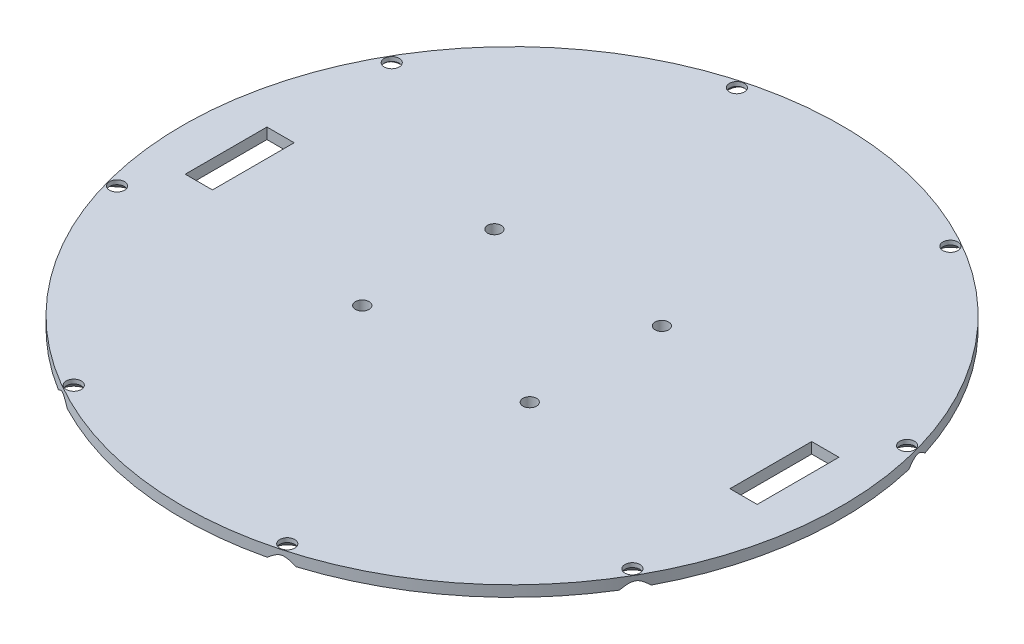
from build123d import *

# Parameters (mm, degrees)
BOTTOM_R                    = 121
BOTTOM_R_2                  = 2.5
BOTTOM_W                    = 10
BOTTOM_H                    = 30
BOTTOM_EXTRUDE_DEPTH        = 4
HOLE_WIZARD_827_D           = 5.5
HOLE_WIZARD_827_DEPTH       = 20
HOLE_WIZARD_827_CSINK_D     = 10.4
HOLE_WIZARD_827_CSINK_ANGLE = 90
HOLE_WIZARD_827_TIP         = 1.652366702


with BuildPart() as part:
    # Bottom → Bottom-Extrude (new body)
    with BuildSketch(Plane(origin=(0, 0, 0), x_dir=(-1, 0, 0), z_dir=(0, 1, 0))):
        with Locations(Location((0, 0, 0), (0, 0, 90))):
            Circle(BOTTOM_R)
        with Locations(Location((-30.75, -24.25, 0), (0, 0, 90))):
            Circle(BOTTOM_R_2, mode=Mode.SUBTRACT)
        with Locations(Location((30.75, -24.25, 0), (0, 0, 90))):
            Circle(BOTTOM_R_2, mode=Mode.SUBTRACT)
        with Locations(Location((30.75, 24.25, 0), (0, 0, 90))):
            Circle(BOTTOM_R_2, mode=Mode.SUBTRACT)
        with Locations(Location((-30.75, 24.25, 0), (0, 0, 90))):
            Circle(BOTTOM_R_2, mode=Mode.SUBTRACT)
        with Locations((100, 0)):
            Rectangle(BOTTOM_W, BOTTOM_H, mode=Mode.SUBTRACT)
        with Locations((-100, 0)):
            Rectangle(BOTTOM_W, BOTTOM_H, mode=Mode.SUBTRACT)
    extrude(amount=BOTTOM_EXTRUDE_DEPTH)

    # Hole Wizard 827
    with Locations(Plane(origin=(-40.138590538, 0, -6.235728401), x_dir=(0.8690947690911651, 0, 0.49464561287691045), z_dir=(0, -1, 0))):
        with Locations((-45.469885408, -97.873538962), (-80.031285228, -14.434938782), (-45.469885408, 69.003661398), (37.968714772, 103.565061218), (121.407314952, 69.003661398), (155.968714772, -14.434938782), (121.407314952, -97.873538962), (37.968714772, -132.434938782)):
            CounterSinkHole(HOLE_WIZARD_827_D / 2, HOLE_WIZARD_827_CSINK_D / 2, depth=HOLE_WIZARD_827_DEPTH, counter_sink_angle=HOLE_WIZARD_827_CSINK_ANGLE)
            with Locations((0, 0, -(HOLE_WIZARD_827_DEPTH + HOLE_WIZARD_827_TIP / 2))):  # 118° drill point
                Cone(0, HOLE_WIZARD_827_D / 2, HOLE_WIZARD_827_TIP, mode=Mode.SUBTRACT)


solid = part.part
